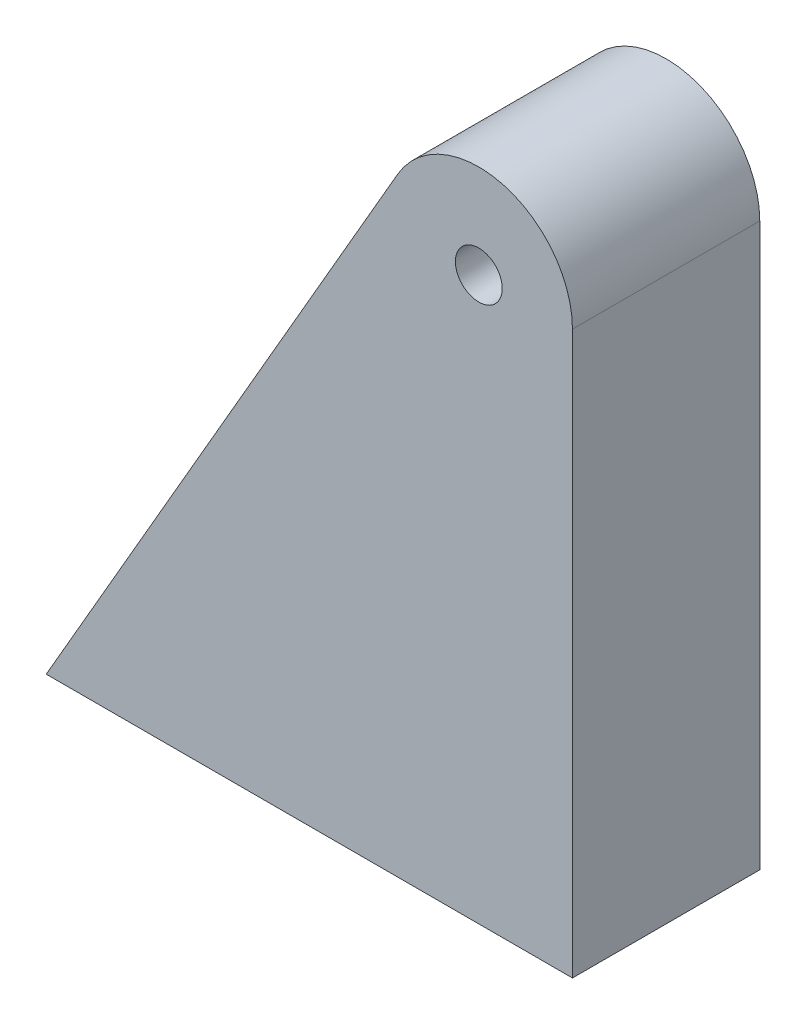
from build123d import *

# Parameters (mm, degrees)
SKETCH1_R           = 1.5875
BOSS_EXTRUDE1_DEPTH = 12.7


with BuildPart() as part:
    # Sketch1 → Boss-Extrude1 (new body)
    with BuildSketch(Plane.XY):
        with BuildLine():
            Line((0, 0), (23.830132361, 41.275))
            ThreePointArc((23.830132361, 41.275), (30.972894611, 44.233628997), (35.679393675, 38.1))
            Line((35.679393675, 38.1), (35.679393675, 0))
            Line((35.679393675, 0), (0, 0))
        make_face()
        with Locations((29.329393675, 38.1)):
            Circle(SKETCH1_R, mode=Mode.SUBTRACT)
    extrude(amount=BOSS_EXTRUDE1_DEPTH)


solid = part.part
